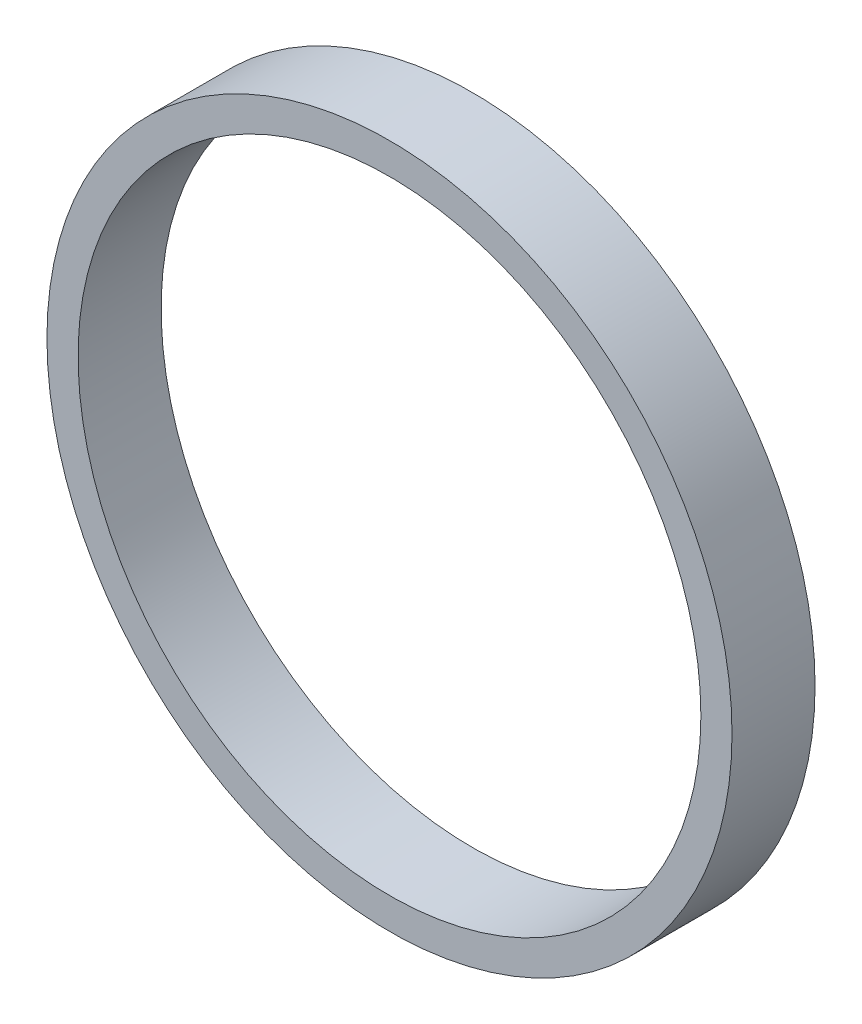
from build123d import *

# Parameters (mm, degrees)
SKETCH1_R           = 16.5
SKETCH1_R_2         = 15
BOSS_EXTRUDE1_DEPTH = 4


with BuildPart() as part:
    # Sketch1 → Boss-Extrude1 (new body)
    with BuildSketch(Plane.XY):
        Circle(SKETCH1_R)
        Circle(SKETCH1_R_2, mode=Mode.SUBTRACT)
    extrude(amount=BOSS_EXTRUDE1_DEPTH)


solid = part.part
